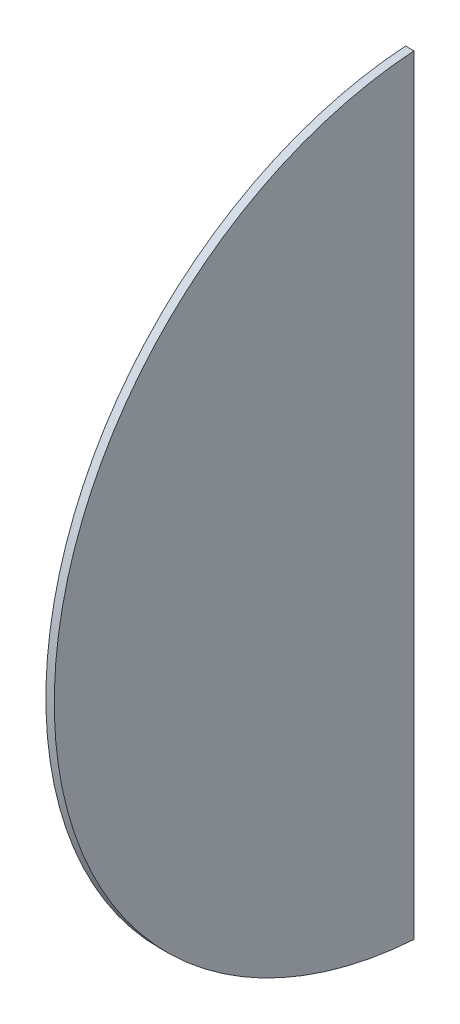
from build123d import *

# Parameters (mm, degrees)
BOSS_EXTRUDE1_DEPTH = 10


with BuildPart() as part:
    # Sketch1 → Boss-Extrude1 (new body)
    with BuildSketch(Plane.YZ):
        with BuildLine():
            Line((-460, 0), (460, 0))
            ThreePointArc((460, 0), (0, 430), (-460, 0))
        make_face()
    extrude(amount=BOSS_EXTRUDE1_DEPTH)


solid = part.part
